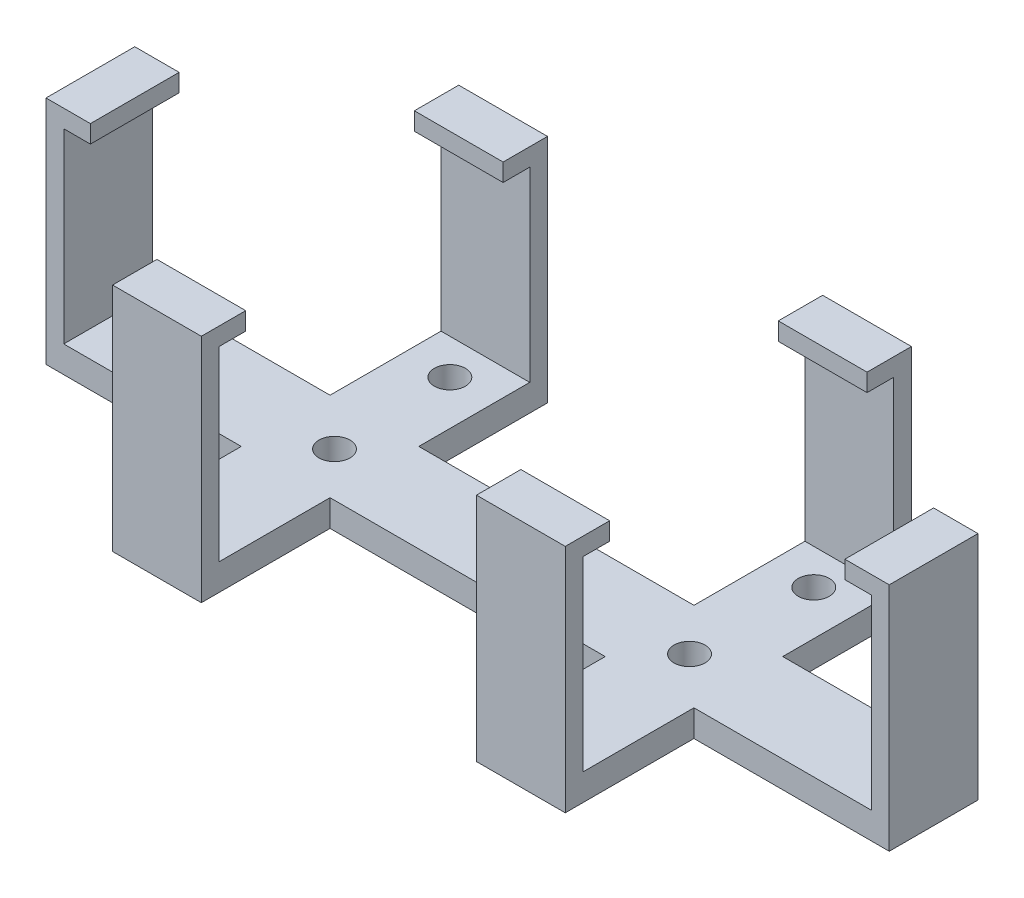
from build123d import *

# Parameters (mm, degrees)
SKETCH1_R           = 1.75
BOSS_EXTRUDE1_DEPTH = 3
SKETCH1_3_W         = 2
SKETCH1_3_H         = 10
SKETCH1_3_W_2       = 10
SKETCH1_3_H_2       = 2
BOSS_EXTRUDE2_DEPTH = 24
SKETCH2_W           = 10
SKETCH2_H           = 5
SKETCH2_W_2         = 5
SKETCH2_H_2         = 10
BOSS_EXTRUDE3_DEPTH = 2
SKETCH3_R           = 1.75
CUT_EXTRUDE1_DEPTH  = 12


with BuildPart() as part:
    # Sketch1 → Boss-Extrude1 (new body)
    with BuildSketch(Plane(origin=(0, 0, 0), x_dir=(1, 0, 0), z_dir=(0, 1, 0))):
        Polygon((-15.142857143, 16.928571429), (-35.142857143, 16.928571429), (-35.142857143, 6.928571429), (-15.142857143, 6.928571429), (-15.142857143, -5.571428571), (-5.142857143, -5.571428571), (-5.142857143, 6.928571429), (25.857142857, 6.928571429), (25.857142857, -5.571428571), (35.857142857, -5.571428571), (35.857142857, 6.928571429), (55.857142857, 6.928571429), (55.857142857, 16.928571429), (35.857142857, 16.928571429), (35.857142857, 29.428571429), (25.857142857, 29.428571429), (25.857142857, 16.928571429), (-5.142857143, 16.928571429), (-5.142857143, 29.428571429), (-15.142857143, 29.428571429), align=None)
        with Locations((-9.642857143, 11.928571429)):
            Circle(SKETCH1_R, mode=Mode.SUBTRACT)
        with Locations((30.357142857, 11.928571429)):
            Circle(SKETCH1_R, mode=Mode.SUBTRACT)
    extrude(amount=BOSS_EXTRUDE1_DEPTH)

    # Sketch1<3> → Boss-Extrude2 (add)
    with BuildSketch(Plane(origin=(0, 0, 0), x_dir=(1, 0, 0), z_dir=(0, 1, 0))):
        with Locations((-36.142857143, 11.928571429)):
            Rectangle(SKETCH1_3_W, SKETCH1_3_H)
        with Locations((-10.142857143, 30.428571429)):
            Rectangle(SKETCH1_3_W_2, SKETCH1_3_H_2)
        with Locations((-10.142857143, -6.571428571)):
            Rectangle(SKETCH1_3_W_2, SKETCH1_3_H_2)
        with Locations((30.857142857, 30.428571429)):
            Rectangle(SKETCH1_3_W_2, SKETCH1_3_H_2)
        with Locations((56.857142857, 11.928571429)):
            Rectangle(SKETCH1_3_W, SKETCH1_3_H)
        with Locations((30.857142857, -6.571428571)):
            Rectangle(SKETCH1_3_W_2, SKETCH1_3_H_2)
    extrude(amount=BOSS_EXTRUDE2_DEPTH)

    # Sketch2 → Boss-Extrude3 (add)
    with BuildSketch(Plane(origin=(0, 24, 0), x_dir=(1, 0, 0), z_dir=(0, 1, 0))):
        with Locations((-10.142857143, 28.928571429)):
            Rectangle(SKETCH2_W, SKETCH2_H)
        with Locations((30.857142857, 28.928571429)):
            Rectangle(SKETCH2_W, SKETCH2_H)
        with Locations((55.357142857, 11.928571429)):
            Rectangle(SKETCH2_W_2, SKETCH2_H_2)
        with Locations((30.857142857, -5.071428571)):
            Rectangle(SKETCH2_W, SKETCH2_H)
        with Locations((-10.142857143, -5.071428571)):
            Rectangle(SKETCH2_W, SKETCH2_H)
        with Locations((-34.642857143, 11.928571429)):
            Rectangle(SKETCH2_W_2, SKETCH2_H_2)
    extrude(amount=BOSS_EXTRUDE3_DEPTH)

    # Sketch3 → Cut-Extrude1 (cut)
    with BuildSketch(Plane.XZ):
        with Locations((-10.142857143, -25.428571429)):
            Circle(SKETCH3_R)
        with Locations((30.857142857, -25.428571429)):
            Circle(SKETCH3_R)
    extrude(amount=-CUT_EXTRUDE1_DEPTH, mode=Mode.SUBTRACT)


solid = part.part
